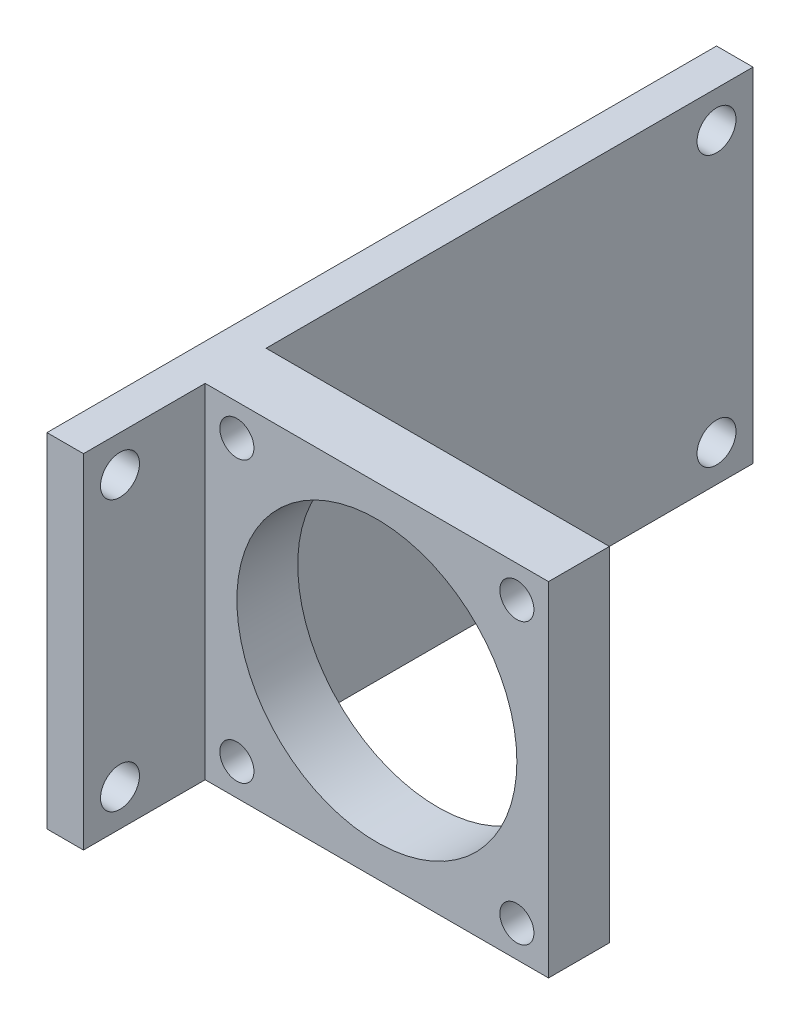
from build123d import *

# Parameters (mm, degrees)
SKETCH2_W           = 28.2
SKETCH2_H           = 28.2
BOSS_EXTRUDE1_DEPTH = 5
SKETCH3_R           = 1.4
CUT_EXTRUDE1_DEPTH  = 5
SKETCH4_R           = 11.5
CUT_EXTRUDE2_DEPTH  = 5
SKETCH7_W           = 55
SKETCH7_H           = 28.2
BOSS_EXTRUDE2_DEPTH = 3
SKETCH10_R          = 1.6
CUT_EXTRUDE7_DEPTH  = 5


with BuildPart() as part:
    # Sketch2 → Boss-Extrude1 (new body)
    with BuildSketch(Plane.XY):
        with Locations((17.317401284, 44.516795377)):
            Rectangle(SKETCH2_W, SKETCH2_H)
    extrude(amount=BOSS_EXTRUDE1_DEPTH)

    # Sketch3 → Cut-Extrude1 (cut)
    with BuildSketch(Plane.XY.offset(5)):
        with Locations((5.817401284, 56.016795377)):
            Circle(SKETCH3_R)
        with Locations((28.817401284, 56.016795377)):
            Circle(SKETCH3_R)
        with Locations((28.817401284, 33.016795377)):
            Circle(SKETCH3_R)
        with Locations((5.817401284, 33.016795377)):
            Circle(SKETCH3_R)
    extrude(amount=-CUT_EXTRUDE1_DEPTH, mode=Mode.SUBTRACT)

    # Sketch4 → Cut-Extrude2 (cut)
    with BuildSketch(Plane.XY.offset(5)):
        with Locations((17.317401284, 44.516795377)):
            Circle(SKETCH4_R)
    extrude(amount=-CUT_EXTRUDE2_DEPTH, mode=Mode.SUBTRACT)

    # Sketch7 → Boss-Extrude2 (add)
    with BuildSketch(Plane.ZY.offset(-3.217401284)):
        with Locations((-12.5, 44.516795377)):
            Rectangle(SKETCH7_W, SKETCH7_H)
    extrude(amount=BOSS_EXTRUDE2_DEPTH)

    # Sketch10 → Cut-Extrude7 (cut)
    with BuildSketch(Plane(origin=(3.217401284, 0, 0), x_dir=(0, 0, -1), z_dir=(1, 0, 0))):
        with Locations(Location((37, 55.616795377, 0), (0, 0, 90))):
            Circle(SKETCH10_R)
        with Locations(Location((37, 33.416795377, 0), (0, 0, 90))):
            Circle(SKETCH10_R)
        with Locations(Location((-12, 55.616795377, 0), (0, 0, 90))):
            Circle(SKETCH10_R)
        with Locations(Location((-12, 33.416795377, 0), (0, 0, 90))):
            Circle(SKETCH10_R)
    extrude(amount=-CUT_EXTRUDE7_DEPTH, mode=Mode.SUBTRACT)


solid = part.part
